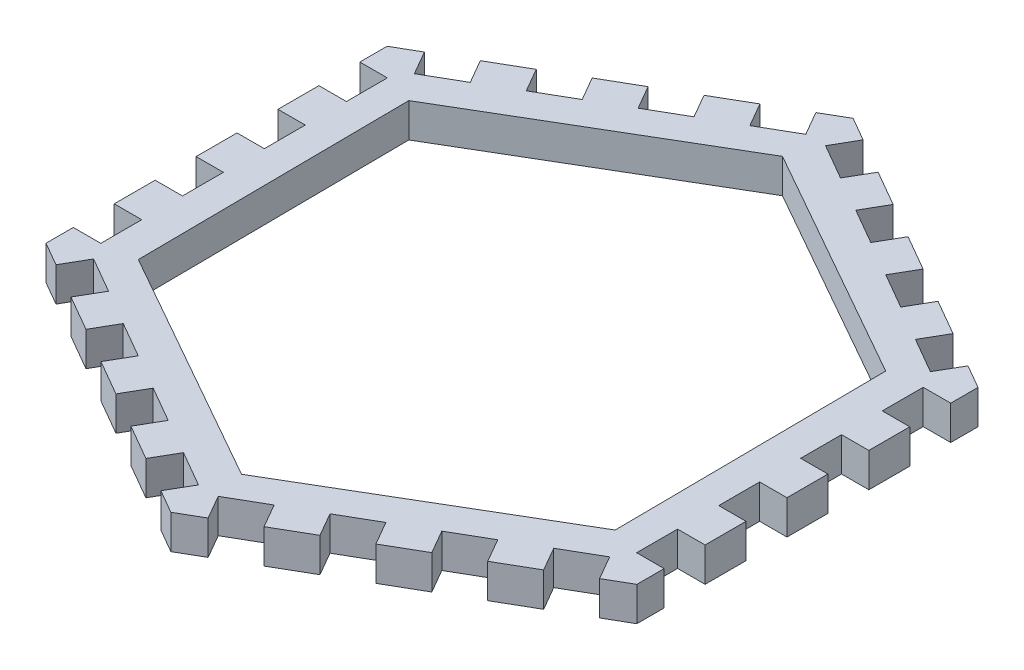
from build123d import *

# Parameters (mm, degrees)
BOSS_EXTRUDE1_DEPTH = 3.175


with BuildPart() as part:
    # Sketch1 → Boss-Extrude1 (new body)
    with BuildSketch(Plane(origin=(0, 0, 0), x_dir=(1, 0, 0), z_dir=(0, 1, 0))):
        Polygon((-27.49630657, 15.875), (-25.296602045, 17.145), (-24.016404155, 14.927632211), (-20.716847366, 16.832632211), (-21.997045256, 19.05), (-18.697488468, 20.955), (-17.427488468, 18.755295474), (-14.127931679, 20.660295474), (-15.397931679, 22.86), (-12.098374891, 24.765), (-10.828374891, 22.565295474), (-7.528818102, 24.470295474), (-8.798818102, 26.67), (-5.499261314, 28.575), (-4.219063424, 26.357632211), (-0.919506636, 28.262632211), (-2.199704526, 30.48), (0, 31.75), (2.199704526, 30.48), (0.919506636, 28.262632211), (4.219063424, 26.357632211), (5.499261314, 28.575), (8.798818102, 26.67), (7.528818102, 24.470295474), (10.828374891, 22.565295474), (12.098374891, 24.765), (15.397931679, 22.86), (14.127931679, 20.660295474), (17.427488468, 18.755295474), (18.697488468, 20.955), (21.997045256, 19.05), (20.716847366, 16.832632211), (24.016404155, 14.927632211), (25.296602045, 17.145), (27.49630657, 15.875), (27.49630657, 13.335), (24.935910791, 13.335), (24.935910791, 9.525), (27.49630657, 9.525), (27.49630657, 5.715), (24.95630657, 5.715), (24.95630657, 1.905), (27.49630657, 1.905), (27.49630657, -1.905), (24.95630657, -1.905), (24.95630657, -5.715), (27.49630657, -5.715), (27.49630657, -9.525), (24.935910791, -9.525), (24.935910791, -13.335), (27.49630657, -13.335), (27.49630657, -15.875), (25.296602045, -17.145), (24.016404155, -14.927632211), (20.716847366, -16.832632211), (21.997045256, -19.05), (18.697488468, -20.955), (17.427488468, -18.755295474), (14.127931679, -20.660295474), (15.397931679, -22.86), (12.098374891, -24.765), (10.828374891, -22.565295474), (7.528818102, -24.470295474), (8.798818102, -26.67), (5.499261314, -28.575), (4.219063424, -26.357632211), (0.919506636, -28.262632211), (2.199704526, -30.48), (0, -31.75), (-2.199704526, -30.48), (-0.919506636, -28.262632211), (-4.219063424, -26.357632211), (-5.499261314, -28.575), (-8.798818102, -26.67), (-7.528818102, -24.470295474), (-10.828374891, -22.565295474), (-12.098374891, -24.765), (-15.397931679, -22.86), (-14.127931679, -20.660295474), (-17.427488468, -18.755295474), (-18.697488468, -20.955), (-21.997045256, -19.05), (-20.716847366, -16.832632211), (-24.016404155, -14.927632211), (-25.296602045, -17.145), (-27.49630657, -15.875), (-27.49630657, -13.335), (-24.935910791, -13.335), (-24.935910791, -9.525), (-27.49630657, -9.525), (-27.49630657, -5.715), (-24.95630657, -5.715), (-24.95630657, -1.905), (-27.49630657, -1.905), (-27.49630657, 1.905), (-24.95630657, 1.905), (-24.95630657, 5.715), (-27.49630657, 5.715), (-27.49630657, 9.525), (-24.935910791, 9.525), (-24.935910791, 13.335), (-27.49630657, 13.335), align=None)
        Polygon((21.883093223, 12.895356956), (-0.226160103, 25.398993122), (-22.109253326, 12.503636166), (-21.883093223, -12.895356956), (0.226160103, -25.398993122), (22.109253326, -12.503636166), align=None, mode=Mode.SUBTRACT)
    extrude(amount=-BOSS_EXTRUDE1_DEPTH)


solid = part.part
